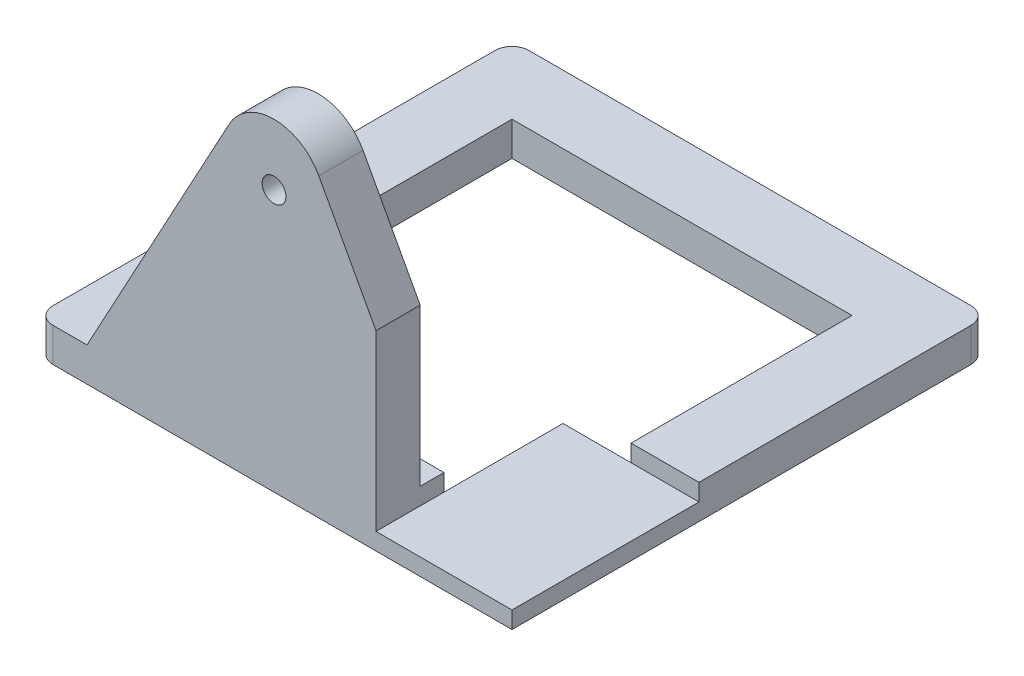
from build123d import *

# Parameters (mm, degrees)
SKETCH1_W                = 140
SKETCH1_H                = 140
SKETCH1_W_2              = 100
SKETCH1_H_2              = 100
BOSS_EXTRUDE1_DEPTH      = 10
BOSS_EXTRUDE2_DEPTH      = 3
BOSS_EXTRUDE2_DEPTH_BACK = 10
SKETCH4_R                = 8.55
CUT_EXTRUDE2_DEPTH       = 6
SKETCH5_R                = 3.5
CUT_EXTRUDE3_DEPTH       = 178.803262062
FILLET1_R                = 5
CUT_EXTRUDE4_START       = 5
SKETCH6_W                = 40
SKETCH6_H                = 55
CUT_EXTRUDE4_DEPTH       = 133.20422734
SKETCH6_3_W              = 40
SKETCH6_3_H              = 55
BOSS_EXTRUDE4_DEPTH      = 5


with BuildPart() as part:
    # Sketch1 → Boss-Extrude1 (new body)
    with BuildSketch(Plane(origin=(0, 0, 0), x_dir=(1, 0, 0), z_dir=(0, 1, 0))):
        Rectangle(SKETCH1_W, SKETCH1_H)
        Rectangle(SKETCH1_W_2, SKETCH1_H_2, mode=Mode.SUBTRACT)
    extrude(amount=BOSS_EXTRUDE1_DEPTH)

    # Sketch2 → Boss-Extrude2 (add, two sides: drawn at the far end of the back side and taken through both)
    with BuildSketch(Plane(origin=(0, 0, 60), x_dir=(-1, 0, 0), z_dir=(0, 0, -1)).offset(-BOSS_EXTRUDE2_DEPTH_BACK)):
        with BuildLine():
            Line((55, 10), (-55, 10))
            Line((-55, 10), (-13.187649977, 87.147439268))
            ThreePointArc((-13.187649977, 87.147439268), (0, 95), (13.187649977, 87.147439268))
            Line((13.187649977, 87.147439268), (55, 10))
        make_face()
    extrude(amount=BOSS_EXTRUDE2_DEPTH + BOSS_EXTRUDE2_DEPTH_BACK)

    # Sketch4 → Cut-Extrude2 (cut)
    with BuildSketch(Plane(origin=(0, 0, 57), x_dir=(-1, 0, 0), z_dir=(0, 0, -1))):
        with Locations((0, 77)):
            Circle(SKETCH4_R)
    extrude(amount=-CUT_EXTRUDE2_DEPTH, mode=Mode.SUBTRACT)

    # Sketch5 → Cut-Extrude3 (cut, through all)
    with BuildSketch(Plane(origin=(0, 0, 63), x_dir=(-1, 0, 0), z_dir=(0, 0, -1))):
        with Locations((0, 77)):
            Circle(SKETCH5_R)
    extrude(amount=-CUT_EXTRUDE3_DEPTH, mode=Mode.SUBTRACT)

    # Fillet1
    fillet1_edges = [part.edges().sort_by_distance(p)[0] for p in [
        (70, 5, 70),
        (-70, 5, 70),
        (-70, 5, -70),
        (70, 5, -70),
    ]]
    fillet(fillet1_edges, radius=FILLET1_R)

    # Sketch6 → Cut-Extrude4 (cut, through all)
    with BuildSketch(Plane(origin=(0, 0, 0), x_dir=(1, 0, 0), z_dir=(0, 1, 0)).offset(CUT_EXTRUDE4_START)):
        with Locations((50, -42.5)):
            Rectangle(SKETCH6_W, SKETCH6_H)
    extrude(amount=CUT_EXTRUDE4_DEPTH, mode=Mode.SUBTRACT)

    # Sketch6<3> → Boss-Extrude4 (add)
    with BuildSketch(Plane(origin=(0, 0, 0), x_dir=(1, 0, 0), z_dir=(0, 1, 0))):
        with Locations((50, -42.5)):
            Rectangle(SKETCH6_3_W, SKETCH6_3_H)
    extrude(amount=BOSS_EXTRUDE4_DEPTH)


solid = part.part
